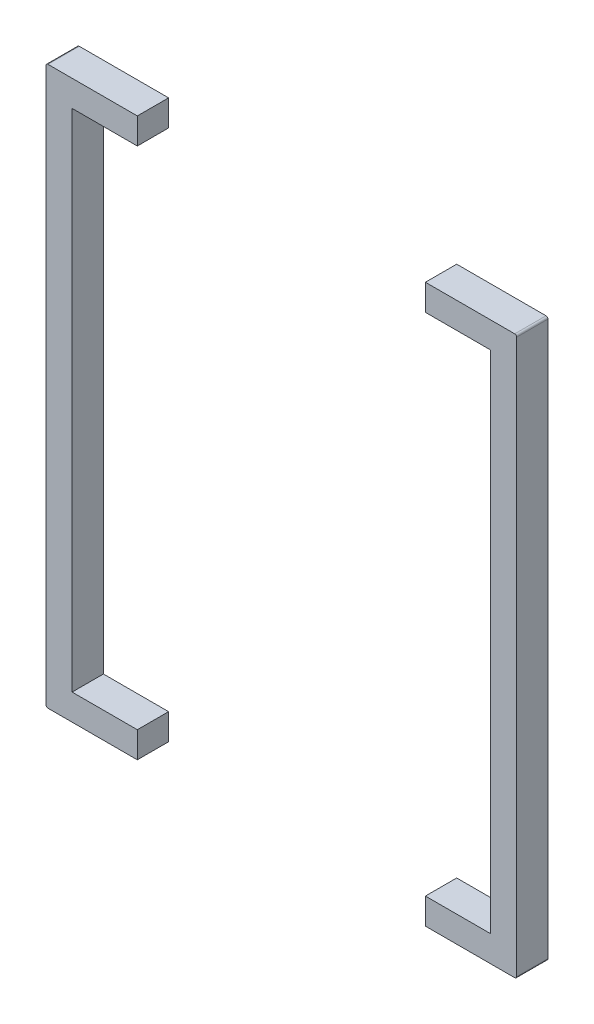
from build123d import *

# Parameters (mm, degrees)
ESBO_O1_W                = 180.47
ESBO_O1_H                = 213.84
RESSALTO_EXTRUS_O1_DEPTH = 12
FILETE2_R                = 0.7366
FILETE3_R                = 0.7366
FILETE4_R                = 0.7366
FILETE5_R                = 0.7366
CORTE_EXTRUS_O1_REACH    = 247.657
ESBO_O2_W                = 160.47
ESBO_O2_H                = 193.84
CORTE_EXTRUS_O2_REACH    = 240.231
ESBO_O5_W                = 110.47
ESBO_O5_H                = 12
CORTE_EXTRUS_O3_REACH    = 240.231
ESBO_O6_W                = 110.47
ESBO_O6_H                = 12


with BuildPart() as part:
    # Esboço1 → Ressalto-extrusão1 (new body)
    with BuildSketch(Plane.XY):
        with Locations((14.08297041, 115.163100963)):
            Rectangle(ESBO_O1_W, ESBO_O1_H)
    extrude(amount=RESSALTO_EXTRUS_O1_DEPTH)

    # Filete2
    filete2_edges = [part.edges().sort_by_distance(p)[0] for p in [
        (104.31797041, 222.083100963, 6),
    ]]
    fillet(filete2_edges, radius=FILETE2_R)

    # Filete3
    filete3_edges = [part.edges().sort_by_distance(p)[0] for p in [
        (104.31797041, 8.243100963, 6),
    ]]
    fillet(filete3_edges, radius=FILETE3_R)

    # Filete4
    filete4_edges = [part.edges().sort_by_distance(p)[0] for p in [
        (-76.15202959, 8.243100963, 6),
    ]]
    fillet(filete4_edges, radius=FILETE4_R)

    # Filete5
    filete5_edges = [part.edges().sort_by_distance(p)[0] for p in [
        (-76.15202959, 222.083100963, 6),
    ]]
    fillet(filete5_edges, radius=FILETE5_R)

    # Esboço2 → Corte-extrusão1 (cut, up to next)
    with BuildSketch(Plane.XY.offset(12), mode=Mode.PRIVATE) as corte_extrus_o1_sk1:
        with Locations((14.08297041, 115.163100963)):
            Rectangle(ESBO_O2_W, ESBO_O2_H)
    corte_extrus_o1_tool1 = extrude(corte_extrus_o1_sk1.sketch, amount=-CORTE_EXTRUS_O1_REACH, mode=Mode.PRIVATE) & part.part
    add(corte_extrus_o1_tool1.solids().sort_by_distance((14.08297, 115.163101, 12))[0], mode=Mode.SUBTRACT)

    # Esboço5 → Corte-extrusão2 (cut, up to next)
    with BuildSketch(Plane(origin=(0, 222.083100963, 0), x_dir=(-1, 0, 0), z_dir=(0, 1, 0)), mode=Mode.PRIVATE) as corte_extrus_o2_sk1:
        with Locations((-14.08297041, 6)):
            Rectangle(ESBO_O5_W, ESBO_O5_H)
    corte_extrus_o2_tool1 = extrude(corte_extrus_o2_sk1.sketch, amount=-CORTE_EXTRUS_O2_REACH, mode=Mode.PRIVATE) & part.part
    add(corte_extrus_o2_tool1.solids().sort_by_distance((14.08297, 222.083101, 6))[0], mode=Mode.SUBTRACT)

    # Esboço6 → Corte-extrusão3 (cut, up to next)
    with BuildSketch(Plane.XZ.offset(-8.243100963), mode=Mode.PRIVATE) as corte_extrus_o3_sk1:
        with Locations((14.08297041, 6)):
            Rectangle(ESBO_O6_W, ESBO_O6_H)
    corte_extrus_o3_tool1 = extrude(corte_extrus_o3_sk1.sketch, amount=-CORTE_EXTRUS_O3_REACH, mode=Mode.PRIVATE) & part.part
    add(corte_extrus_o3_tool1.solids().sort_by_distance((14.08297, 8.243101, 6))[0], mode=Mode.SUBTRACT)


with BuildPart() as corte_extrus_o3_piece_1:
    # of the separate pieces the step leaves, piece 1, a body of its own (corte_extrus_o3_pieces)
    add(part.part.solids().sort_by_distance((-76.15202959, 221.346500963, 0))[0])


with BuildPart() as corte_extrus_o3_piece_2:
    # of the separate pieces the step leaves, piece 2, a body of its own (corte_extrus_o3_pieces)
    add(part.part.solids().sort_by_distance((103.58137041, 8.243100963, 0))[0])


solid = Compound([corte_extrus_o3_piece_1.part, corte_extrus_o3_piece_2.part])
